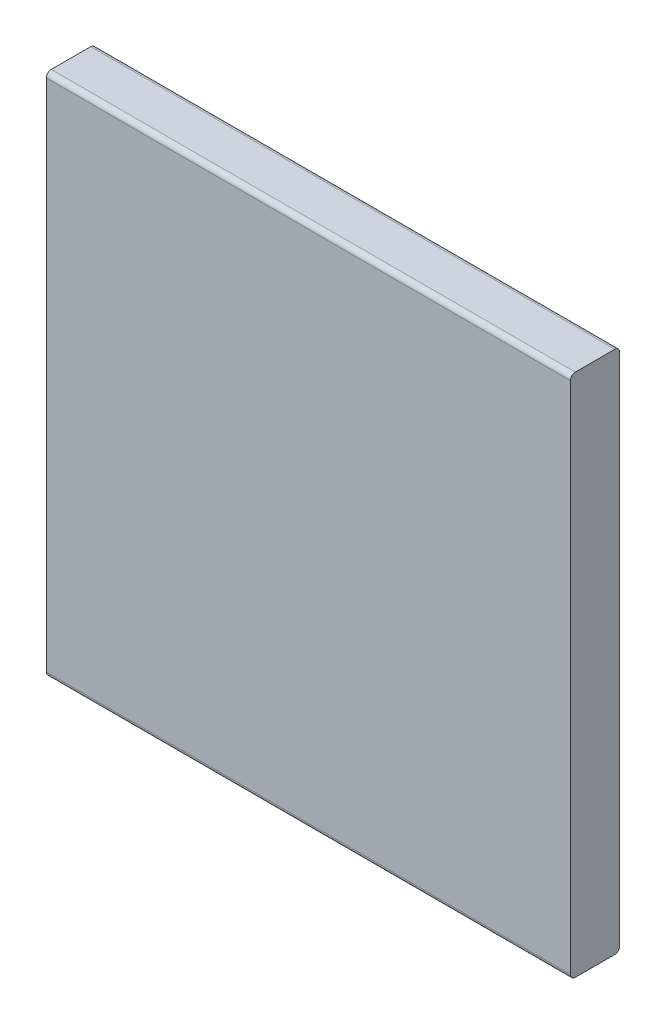
from build123d import *

# Parameters (mm, degrees)
BOSS_EXTRUDE1_DEPTH      = 2.3876
BOSS_EXTRUDE1_DEPTH_BACK = 2.3876
SKETCH3_W                = 50.8
SKETCH3_H                = 50.8
FILLET1_R                = 0.47752


with BuildPart() as part:
    # Sketch3 → Boss-Extrude1 (new, two sides: drawn at the far end of the back side and taken through both)
    with BuildSketch(Plane.XY.offset(-BOSS_EXTRUDE1_DEPTH_BACK)):
        Rectangle(SKETCH3_W, SKETCH3_H)
    extrude(amount=BOSS_EXTRUDE1_DEPTH + BOSS_EXTRUDE1_DEPTH_BACK)

    # Fillet1
    fillet1_edges = [part.edges().sort_by_distance(p)[0] for p in [
        (0, -25.4, 2.3876),
        (0, 25.4, -2.3876),
        (0, 25.4, 2.3876),
        (0, -25.4, -2.3876),
    ]]
    fillet(fillet1_edges, radius=FILLET1_R)


solid = part.part
